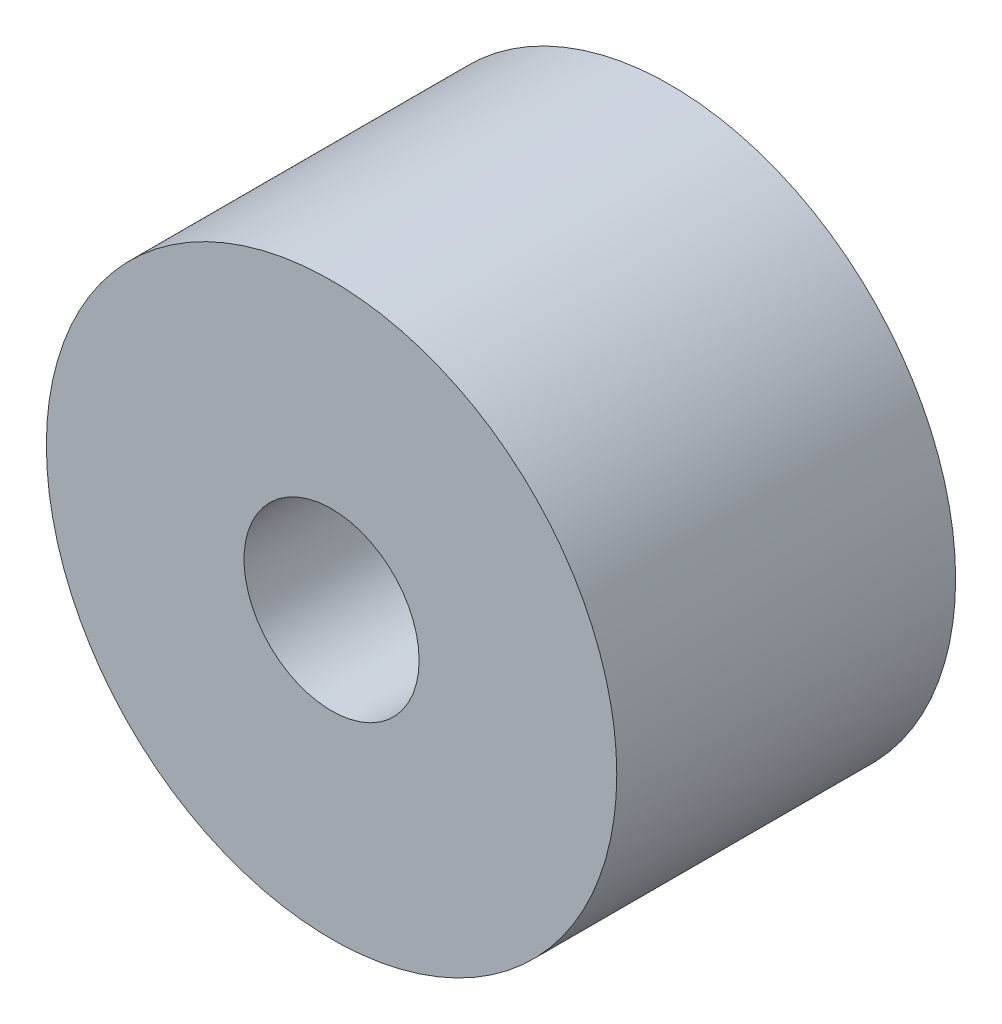
from build123d import *

# Parameters (mm, degrees)
SZKIC1_R                    = 5.05
SZKIC1_R_2                  = 1.55
DODANIE_WYCI_GNI_CIE1_DEPTH = 6


with BuildPart() as part:
    # Szkic1 → Dodanie-wyciągnięcie1 (new body)
    with BuildSketch(Plane.XY):
        with Locations((200.527180247, 1578.676637887)):
            Circle(SZKIC1_R)
        with Locations((200.527180247, 1578.676637887)):
            Circle(SZKIC1_R_2, mode=Mode.SUBTRACT)
    extrude(amount=DODANIE_WYCI_GNI_CIE1_DEPTH)


solid = part.part
